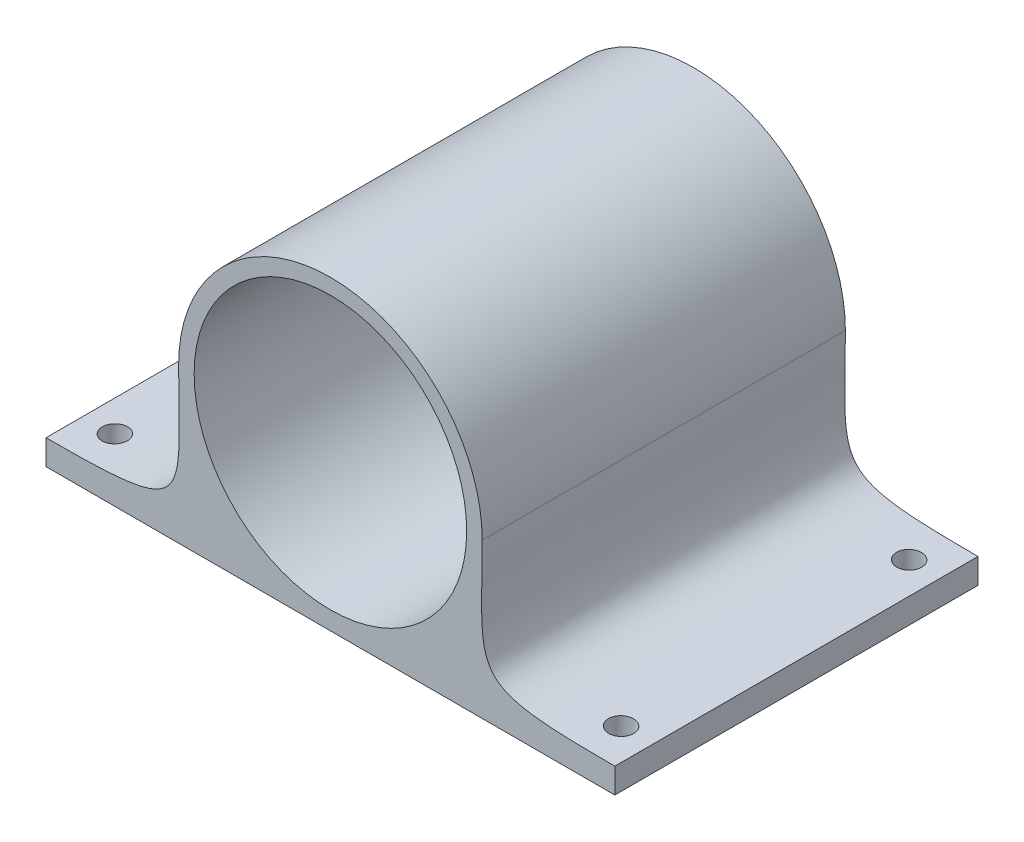
from build123d import *

# Parameters (mm, degrees)
SKETCH1_R           = 21.76
BOSS_EXTRUDE1_DEPTH = 58
SKETCH1_4_R         = 21.76
BOSS_EXTRUDE2_DEPTH = 3
SKETCH2_R           = 2
CUT_EXTRUDE2_DEPTH  = 30
SKETCH2_3_R         = 2.006014876
CUT_EXTRUDE3_DEPTH  = 30


with BuildPart() as part:
    # Sketch1 → Boss-Extrude1 (new body)
    with BuildSketch(Plane.XY):
        with BuildLine():
            Line((-45.421940828, -20.666245921), (-45.421940828, -24.666245921))
            Line((-45.421940828, -24.666245921), (45.421940828, -24.666245921))
            Line((45.421940828, -24.666245921), (45.421940828, -20.666245921))
            add(Edge.make_bspline(
                [(45.421940828, -20.666245921), (21.532203305, -20.666245921), (24.241475666, -19.078845964), (24.241475666, 0)],
                knots=[0, 0, 0, 0, 1, 1, 1, 1], degree=3))
            ThreePointArc((24.241475666, 0), (0, 24.241475666), (-24.241475666, 0))
            add(Edge.make_bspline(
                [(-45.421940828, -20.666245921), (-21.532203305, -20.666245921), (-24.241475666, -19.078845964), (-24.241475666, 0)],
                knots=[0, 0, 0, 0, 1, 1, 1, 1], degree=3))
        make_face()
        Circle(SKETCH1_R, mode=Mode.SUBTRACT)
    extrude(amount=BOSS_EXTRUDE1_DEPTH)

    # Sketch1<4> → Boss-Extrude2 (add)
    with BuildSketch(Plane.XY):
        Circle(SKETCH1_4_R)
        with BuildLine():
            ThreePointArc((0, -10), (-7.071067812, 7.071067812), (10, 0))
            ThreePointArc((10, 0), (7.071067812, -7.071067812), (0, -10))
        make_face(mode=Mode.SUBTRACT)
    extrude(amount=BOSS_EXTRUDE2_DEPTH)

    # Sketch2 → Cut-Extrude2 (cut)
    with BuildSketch(Plane(origin=(0, 0, 0), x_dir=(1, 0, 0), z_dir=(0, 1, 0))):
        with Locations((-40.421940828, -6)):
            Circle(SKETCH2_R)
        with Locations((40.421940828, -6)):
            Circle(SKETCH2_R)
    extrude(amount=-CUT_EXTRUDE2_DEPTH, mode=Mode.SUBTRACT)

    # Sketch2<3> → Cut-Extrude3 (cut)
    with BuildSketch(Plane(origin=(0, 0, 0), x_dir=(1, 0, 0), z_dir=(0, 1, 0))):
        with Locations((-40.421940828, -52)):
            Circle(SKETCH2_3_R)
        with Locations((40.421940828, -52)):
            Circle(SKETCH2_3_R)
    extrude(amount=-CUT_EXTRUDE3_DEPTH, mode=Mode.SUBTRACT)


solid = part.part
